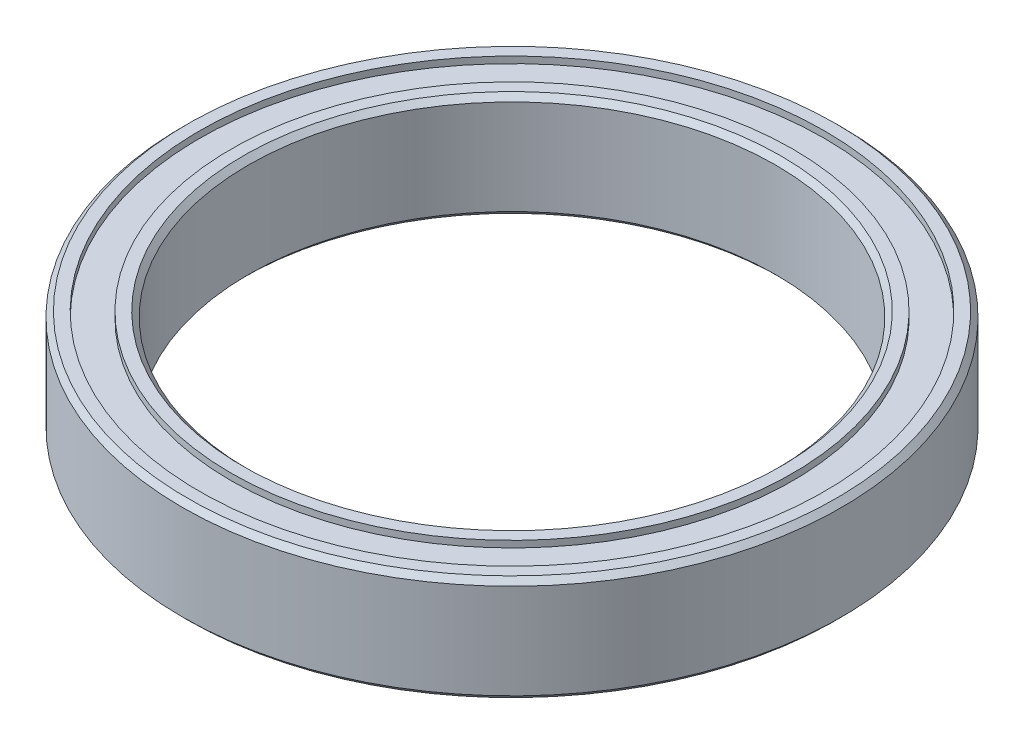
from build123d import *

# Parameters (mm, degrees)
FASE1_SIZE = 0.2


with BuildPart() as part:
    # Skizze2 → Rotation2 (revolve)
    with BuildSketch(Plane(origin=(0, 0, 0), x_dir=(0, 0, -1), z_dir=(1, 0, 0)), mode=Mode.PRIVATE) as rotation2_sk:
        Polygon((-12.5, 2), (-12.5, -2), (-11.85, -2), (-11.85, -1.75), (-10.65, -1.75), (-10.65, -2), (-10, -2), (-10, 2), (-10.65, 2), (-10.65, 1.75), (-11.85, 1.75), (-11.85, 2), align=None)
    revolve(rotation2_sk.sketch.rotate(Axis((0, -18.122913865, 0), (0, 1, 0)), 180), axis=Axis((0, -18.122913865, 0), (0, 1, 0)))

    # Fase1
    fase1_edges = [part.edges().sort_by_distance(p)[0] for p in [
        (0, 2, 10),
        (0, -2, 10),
        (0, -2, 12.5),
        (0, 2, 12.5),
    ]]
    chamfer(fase1_edges, length=FASE1_SIZE)


solid = part.part
